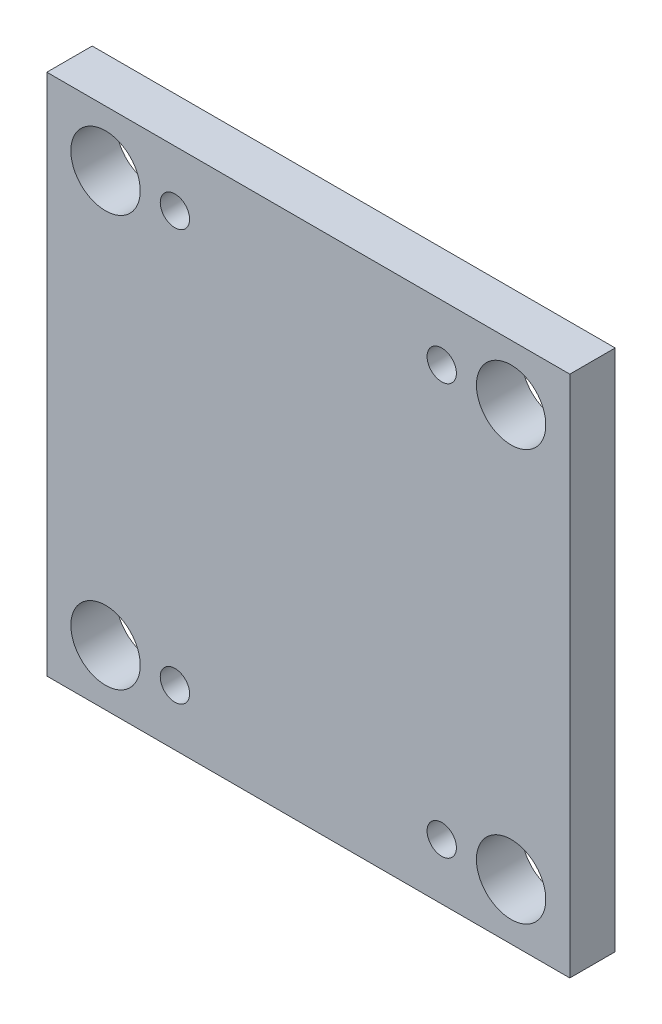
from build123d import *

# Parameters (mm, degrees)
SKETCH_1_W      = 196
SKETCH_1_H      = 196
SKETCH_1_R      = 5.5
SKETCH_1_R_2    = 5.499997081
SKETCH_1_R_3    = 13
EXTRUDE_1_DEPTH = 17


with BuildPart() as part:
    # Эскиз1 → Бобышка-Вытянуть1 (new body)
    with BuildSketch(Plane.XY.offset(17)):
        Rectangle(SKETCH_1_W, SKETCH_1_H)
        with Locations(Location((-50, -77, 0), (0, 0, 180))):
            Circle(SKETCH_1_R, mode=Mode.SUBTRACT)
        with Locations(Location((-50.000002921, 76.99985459, 0), (0, 0, 180))):
            Circle(SKETCH_1_R_2, mode=Mode.SUBTRACT)
        with Locations(Location((50, -77, 0), (0, 0, 180))):
            Circle(SKETCH_1_R, mode=Mode.SUBTRACT)
        with Locations(Location((49.999997079, 76.99985459, 0), (0, 0, 180))):
            Circle(SKETCH_1_R_2, mode=Mode.SUBTRACT)
        with Locations(Location((-76, 77, 0), (0, 0, 180))):
            Circle(SKETCH_1_R_3, mode=Mode.SUBTRACT)
        with Locations(Location((-76, -77, 0), (0, 0, 180))):
            Circle(SKETCH_1_R_3, mode=Mode.SUBTRACT)
        with Locations(Location((76, -77, 0), (0, 0, 180))):
            Circle(SKETCH_1_R_3, mode=Mode.SUBTRACT)
        with Locations(Location((76, 77, 0), (0, 0, 180))):
            Circle(SKETCH_1_R_3, mode=Mode.SUBTRACT)
    extrude(amount=-EXTRUDE_1_DEPTH)


solid = part.part
